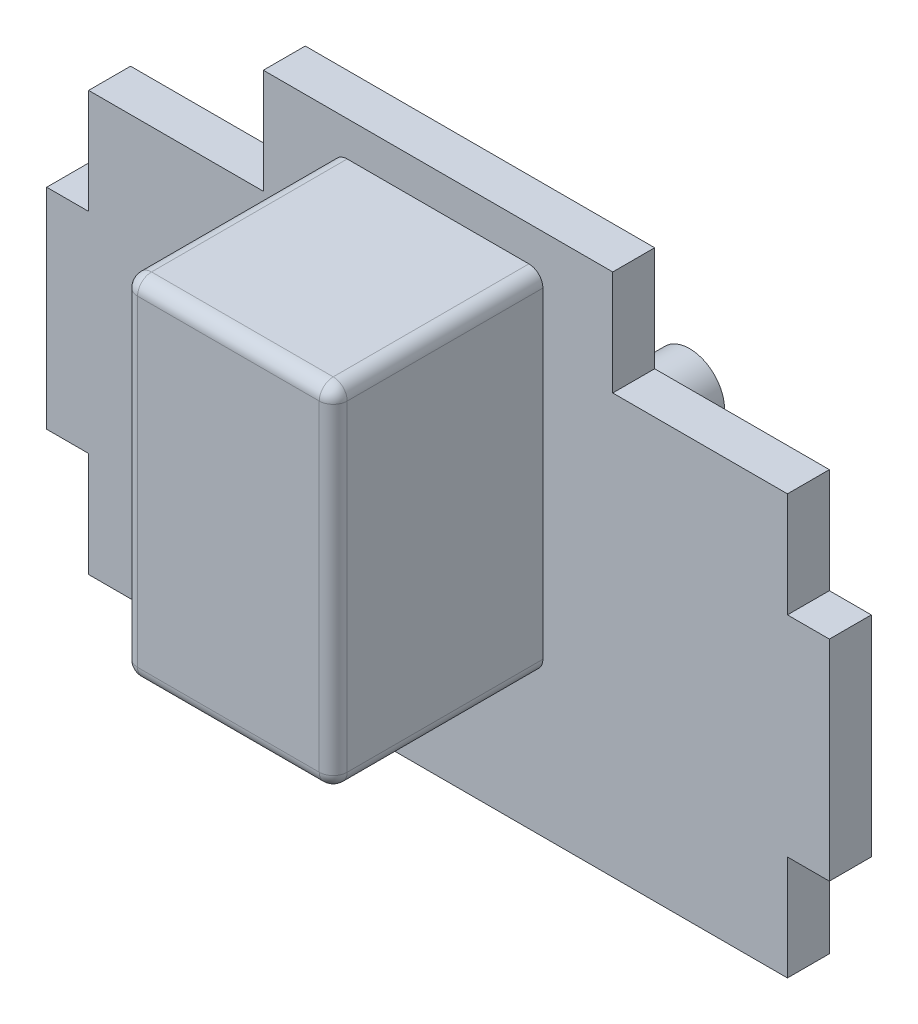
from build123d import *

# Parameters (mm, degrees)
BOSS_EXTRUDE1_DEPTH = 0.3
BOSS_EXTRUDE2_DEPTH = 1.5
FILLET1_R           = 0.1
SKETCH4_R           = 0.25
BOSS_EXTRUDE3_DEPTH = 1.5
SKETCH5_W           = 2.5
SKETCH5_H           = 0.5
CUT_EXTRUDE1_DEPTH  = 10


with BuildPart() as part:
    # Sketch2 → Boss-Extrude1 (new body)
    with BuildSketch(Plane.XY):
        Polygon((-1.25, 0), (1.25, 0), (1.25, -1.25), (2.5, -1.25), (2.5, -2), (2.8, -2), (2.8, -3.5), (2.5, -3.5), (2.5, -4.25), (-2.5, -4.25), (-2.5, -3.5), (-2.8, -3.5), (-2.8, -2), (-2.5, -2), (-2.5, -1.25), (-1.25, -1.25), align=None)
    extrude(amount=BOSS_EXTRUDE1_DEPTH)

    # Sketch3 → Boss-Extrude2 (add)
    with BuildSketch(Plane.XY.offset(0.3)):
        Polygon((-0.75, -3.25), (0.75, -3.25), (0.75, -0.75), (0, -0.75), (-0.75, -0.75), align=None)
    extrude(amount=BOSS_EXTRUDE2_DEPTH)

    # Fillet1
    fillet1_edges = [part.edges().sort_by_distance(p)[0] for p in [
        (-0.75, -3.25, 1.05),
        (0.75, -3.25, 1.05),
        (0, -0.75, 1.8),
        (0.75, -0.75, 1.05),
        (-0.75, -0.75, 1.05),
        (0, -3.25, 1.8),
        (0.75, -2, 1.8),
        (-0.75, -2, 1.8),
    ]]
    fillet(fillet1_edges, radius=FILLET1_R)

    # Sketch4 → Boss-Extrude3 (add)
    with BuildSketch(Plane(origin=(0, 0, 0), x_dir=(-1, 0, 0), z_dir=(0, 0, -1))):
        with Locations(Location((0, -2.75, 0), (0, 0, 180))):
            Circle(SKETCH4_R)
    extrude(amount=BOSS_EXTRUDE3_DEPTH)

    # Sketch5 → Cut-Extrude1 (cut)
    with BuildSketch(Plane(origin=(0, 0, 0), x_dir=(-1, 0, 0), z_dir=(0, 0, -1))):
        with Locations((0, -0.25)):
            Rectangle(SKETCH5_W, SKETCH5_H)
    extrude(amount=-CUT_EXTRUDE1_DEPTH, mode=Mode.SUBTRACT)


solid = part.part
